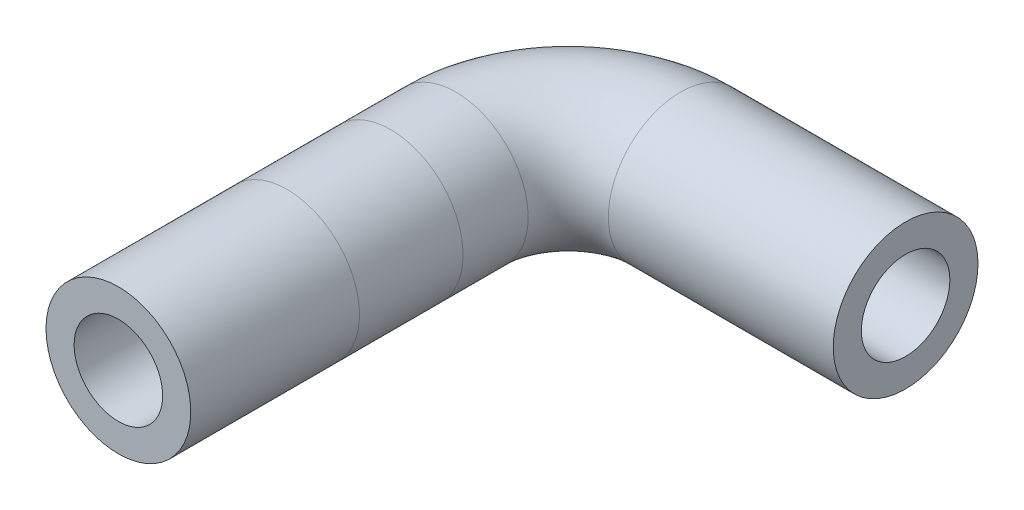
from build123d import *

# Parameters (mm, degrees)
SWEEP1_PROFILE_R     = 8.175
CUT_SWEEP1_PROFILE_R = 5


with BuildPart() as part:
    # Sweep1: sweep along a curve in space
    with BuildLine() as sweep1_path:
        Line((-39.450636639, 0, 30.750046958), (-39.450636639, 0, 11.700046958))
        Line((-39.450636639, 0, 0), (-39.450636639, 0, 11.700046958))
        Line((-39.450636639, 0, -7.349953042), (-39.450636639, 0, 0))
        ThreePointArc((-39.450636639, 0, -7.349953042), (-35.73089276, 0, -16.330209163), (-26.750636639, 0, -20.049953042))
        Line((-26.750636639, 0, -20.049953042), (-1.350636639, 0, -20.049953042))
    # Sweep1 profile (on start of the path) → Sweep1 (sweep)
    with BuildSketch(Plane(origin=(-39.450636639, 0, 30.750046958), x_dir=(-1, 0, 0), z_dir=(0, 0, -1))):
        Circle(SWEEP1_PROFILE_R)
    sweep(path=sweep1_path.line)

    # Cut-Sweep1: sweep along a curve in space
    with BuildLine() as cut_sweep1_path:
        Line((-39.450636639, 0, 30.750046958), (-39.450636639, 0, 11.700046958))
        Line((-39.450636639, 0, 0), (-39.450636639, 0, 11.700046958))
        Line((-39.450636639, 0, -7.349953042), (-39.450636639, 0, 0))
        ThreePointArc((-39.450636639, 0, -7.349953042), (-35.73089276, 0, -16.330209163), (-26.750636639, 0, -20.049953042))
        Line((-26.750636639, 0, -20.049953042), (-1.350636639, 0, -20.049953042))
    # Cut-Sweep1 profile (on start of the path) → Cut-Sweep1 (sweep, cut)
    with BuildSketch(Plane(origin=(-39.450636639, 0, 30.750046958), x_dir=(-1, 0, 0), z_dir=(0, 0, -1))):
        Circle(CUT_SWEEP1_PROFILE_R)
    sweep(path=cut_sweep1_path.line, mode=Mode.SUBTRACT)


solid = part.part
